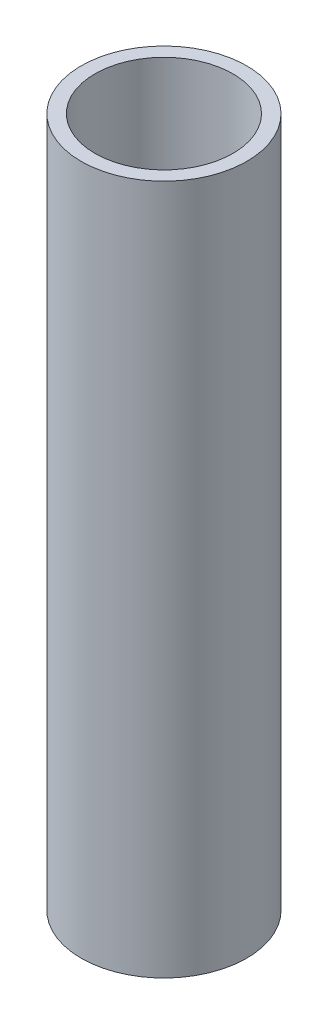
from build123d import *

# Parameters (mm, degrees)
SKETCH_1_W = 4
SKETCH_1_H = 200


with BuildPart() as part:
    # Эскиз1 → Повернуть-Тонкостенный1 (revolve)
    with BuildSketch(Plane.XY):
        with Locations((-22, 100)):
            Rectangle(SKETCH_1_W, SKETCH_1_H)
    revolve(axis=Axis((0, 26.168985987, 0), (0, -1, 0)))


solid = part.part
